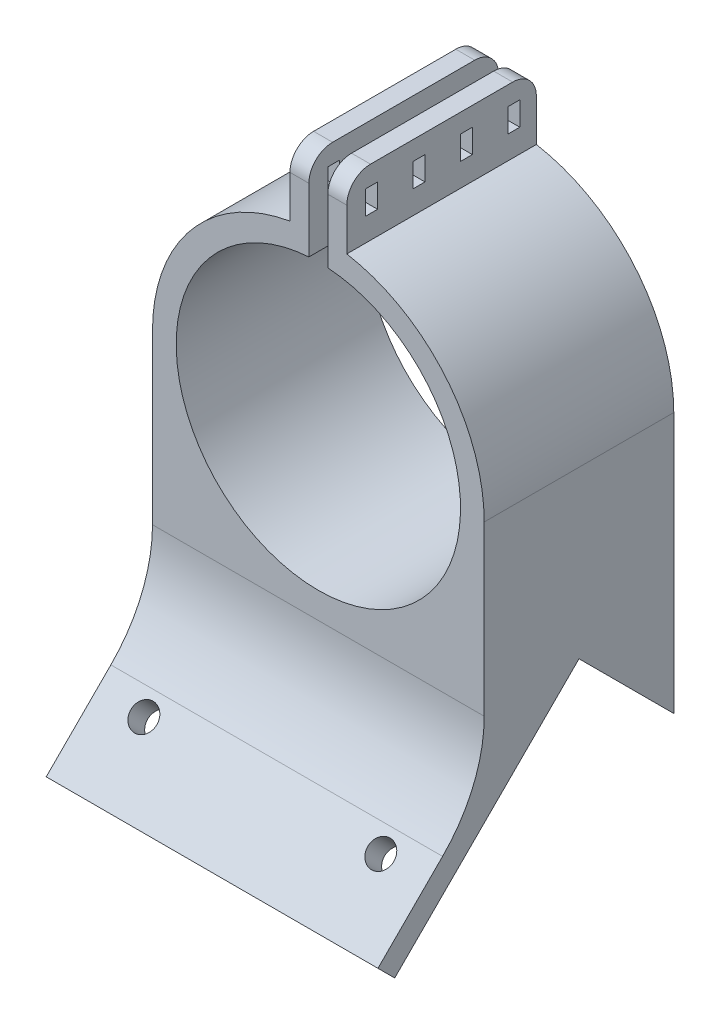
from build123d import *

# Parameters (mm, degrees)
ESQUISSE1_R                = 35
BOSS_EXTRU_1_DEPTH         = 40
ESQUISSE6_W                = 70
ESQUISSE6_H                = 40
BOSS_EXTRU_3_DEPTH         = 70
ESQUISSE2_R                = 30
ENL_V_MAT_EXTRU_1_DEPTH    = 40
BOSS_EXTRU_2_START         = 40
BOSS_EXTRU_2_DEPTH         = 40
ESQUISSE4_W                = 4
ESQUISSE4_H                = 20
ENL_V_MAT_EXTRU_2_DEPTH    = 40
ESQUISSE5_W                = 2.5
ESQUISSE5_H                = 5
ENL_V_MAT_EXTRU_3_DEPTH    = 91.44888059
R_P_TITION_LIN_AIRE1_COUNT = 4
R_P_TITION_LIN_AIRE1_PITCH = 10
ENL_V_MAT_EXTRU_4_DEPTH    = 107.77078252
ESQUISSE8_W                = 70
ESQUISSE8_H                = 55
BOSS_EXTRU_4_DEPTH         = 5
D_GAGEMENT_M51_D           = 5.5
CONG_1_R                   = 30
CONG_2_R                   = 5


with BuildPart() as part:
    # Esquisse1 → Boss.-Extru.1 (new body)
    with BuildSketch(Plane.XY):
        Circle(ESQUISSE1_R)
    extrude(amount=BOSS_EXTRU_1_DEPTH)

    # Esquisse6 → Boss.-Extru.3 (add)
    with BuildSketch(Plane(origin=(0, 0, 0), x_dir=(1, 0, 0), z_dir=(0, 1, 0))):
        with Locations((0, -20)):
            Rectangle(ESQUISSE6_W, ESQUISSE6_H)
    extrude(amount=-BOSS_EXTRU_3_DEPTH)

    # Esquisse2 → Enlèv. mat.-Extru.1 (cut)
    with BuildSketch(Plane.XY.offset(40)):
        Circle(ESQUISSE2_R)
    extrude(amount=-ENL_V_MAT_EXTRU_1_DEPTH, mode=Mode.SUBTRACT)

    # Esquisse3 → Boss.-Extru.2 (add)
    with BuildSketch(Plane.XY.offset(BOSS_EXTRU_2_START)):
        with BuildLine():
            Line((-6, 29.393876913), (-6, 48.393876913))
            Line((-6, 48.393876913), (6, 48.393876913))
            Line((6, 48.393876913), (6, 29.393876913))
            ThreePointArc((6, 29.393876913), (0, 30), (-6, 29.393876913))
        make_face()
    extrude(amount=-BOSS_EXTRU_2_DEPTH)

    # Esquisse4 → Enlèv. mat.-Extru.2 (cut)
    with BuildSketch(Plane.XY.offset(40)):
        with Locations((0, 38.393876913)):
            Rectangle(ESQUISSE4_W, ESQUISSE4_H)
    extrude(amount=-ENL_V_MAT_EXTRU_2_DEPTH, mode=Mode.SUBTRACT)

    # Esquisse5 → Enlèv. mat.-Extru.3 (cut, through all)
    with BuildSketch(Plane(origin=(6, 0, 0), x_dir=(0, 0, -1), z_dir=(1, 0, 0))):
        with Locations((-34.75, 41.893876913)):
            Rectangle(ESQUISSE5_W, ESQUISSE5_H)
    enl_v_mat_extru_3 = extrude(amount=-ENL_V_MAT_EXTRU_3_DEPTH, mode=Mode.SUBTRACT)

    # Répétition linéaire1: Enlèv. mat.-Extru.3 ×4
    with Locations(*[(0, 0, -i * R_P_TITION_LIN_AIRE1_PITCH) for i in range(1, R_P_TITION_LIN_AIRE1_COUNT)]):
        add(enl_v_mat_extru_3, mode=Mode.SUBTRACT)

    # Esquisse7 → Enlèv. mat.-Extru.4 (cut, through all)
    with BuildSketch(Plane.ZY.offset(35)):
        Polygon((-15, -70), (20, -35), (55, -70), align=None)
    extrude(amount=-ENL_V_MAT_EXTRU_4_DEPTH, mode=Mode.SUBTRACT)

    # Esquisse8 → Boss.-Extru.4 (add)
    with BuildSketch(Plane(origin=(0, -7.5, -7.5), x_dir=(1, 0, 0), z_dir=(0, -0.7071067811865515, -0.7071067811865436))):
        with Locations((0, 66.390872965)):
            Rectangle(ESQUISSE8_W, ESQUISSE8_H)
    extrude(amount=-BOSS_EXTRU_4_DEPTH)

    # Dégagement M51 (through all)
    with Locations(Plane(origin=(0, -3.964466094, -3.964466094), x_dir=(1, 0, 0), z_dir=(0, 0.7071067811865517, 0.7071067811865435))):
        with Locations((-25, -78.890872965), (25, -78.890872965)):
            Hole(D_GAGEMENT_M51_D / 2)

    # Congé1
    cong_1_edges = [part.edges().sort_by_distance(p)[0] for p in [
        (0, -47.928932188, 40),
    ]]
    fillet(cong_1_edges, radius=CONG_1_R)

    # Congé2
    cong_2_edges = [part.edges().sort_by_distance(p)[0] for p in [
        (4, 48.393876913, 40),
        (4, 48.393876913, 0),
        (-4, 48.393876913, 0),
        (-4, 48.393876913, 40),
    ]]
    fillet(cong_2_edges, radius=CONG_2_R)


solid = part.part
